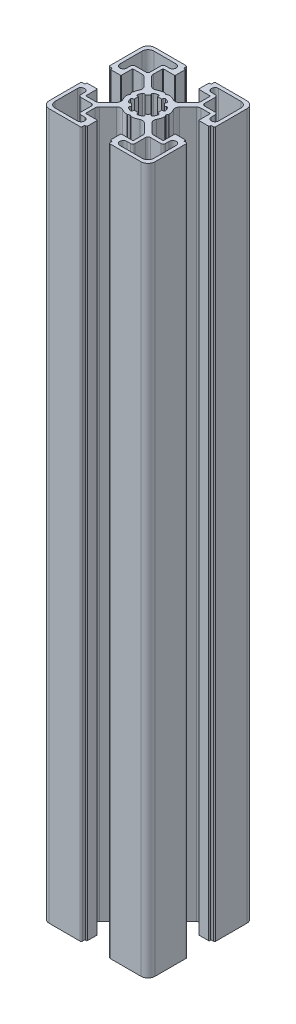
from build123d import *

# Parameters (mm, degrees)
BOSS_EXTRUDE1_DEPTH = 300


with BuildPart() as part:
    # Sketch1 → Boss-Extrude1 (new body)
    with BuildSketch(Plane(origin=(0, 0, 0), x_dir=(1, 0, 0), z_dir=(0, 1, 0))):
        with BuildLine():
            Line((7.563483841, 5.858695924), (11.129779796, 9.424987881))
            ThreePointArc((11.129779796, 9.424987881), (11.76062452, 9.846504465), (12.504756421, 9.994521395))
            Line((12.504756421, 9.994521395), (16.316902359, 9.994521395))
            ThreePointArc((16.316902359, 9.994521395), (16.458323963, 9.935942648), (16.51690271, 9.794521044))
            Line((16.51690271, 9.794521044), (16.51690271, 5.20001408))
            ThreePointArc((16.51690271, 5.20001408), (16.575481456, 5.058592476), (16.716903061, 5.000013729))
            Line((16.716903061, 5.000013729), (20.719599813, 5.000013729))
            ThreePointArc((20.719599813, 5.000013729), (20.931731335, 5.087881483), (21.019599089, 5.300013005))
            Line((21.019599089, 5.300013005), (21.019599089, 5.500003954))
            ThreePointArc((21.019599089, 5.500003954), (21.107466988, 5.71213583), (21.319598864, 5.800003729))
            Line((21.319598864, 5.800003729), (21.999979422, 5.800003729))
            ThreePointArc((21.999979422, 5.800003729), (22.353532548, 5.946450229), (22.499979048, 6.300003356))
            Line((22.499979048, 6.300003356), (22.499979048, 19.500015971))
            ThreePointArc((22.499979048, 19.500015971), (21.621300048, 21.62133473), (19.499981289, 22.50001373))
            Line((19.499981289, 22.50001373), (6.37570892, 22.50001373))
            ThreePointArc((6.37570892, 22.50001373), (6.022155794, 22.35356723), (5.875709294, 22.000014103))
            Line((5.875709294, 22.000014103), (5.875709294, 21.300013005))
            ThreePointArc((5.875709294, 21.300013005), (5.78784154, 21.087881482), (5.575710018, 21.000013729))
            Line((5.575710018, 21.000013729), (5.299998684, 21.000013729))
            ThreePointArc((5.299998684, 21.000013729), (5.087867516, 20.912146122), (4.999999909, 20.700014953))
            Line((4.999999909, 20.700014953), (4.999999909, 16.666812288))
            ThreePointArc((4.999999909, 16.666812288), (5.058578802, 16.52539033), (5.20000076, 16.466811437))
            Line((5.20000076, 16.466811437), (9.905385127, 16.466811437))
            ThreePointArc((9.905385127, 16.466811437), (10.046806731, 16.408232691), (10.105385478, 16.266811086))
            Line((10.105385478, 16.266811086), (10.105385478, 12.471582811))
            ThreePointArc((10.105385478, 12.471582811), (9.953144497, 11.706215717), (9.519598864, 11.057368824))
            Line((9.519598864, 11.057368824), (5.944897897, 7.482667857))
            ThreePointArc((5.944897897, 7.482667857), (4.854602604, 6.96783564), (3.666501718, 7.17329201))
            ThreePointArc((3.666501718, 7.17329201), (2.308631207, 7.714000899), (0.875344921, 8.000128222))
            ThreePointArc((0.875344921, 8.000128222), (0.813048151, 7.996979672), (0.754751151, 7.974792726))
            Line((0.754751151, 7.974792726), (0.112630526, 7.606936313))
            ThreePointArc((0.112630526, 7.606936313), (0.062965968, 7.559088119), (2.065e-06, 7.530953356))
            ThreePointArc((2.065e-06, 7.530953356), (-0.062961837, 7.559088119), (-0.112626394, 7.606936313))
            Line((-0.112626394, 7.606936313), (-0.754745572, 7.974791896))
            ThreePointArc((-0.754745572, 7.974791896), (-0.813042564, 7.99697884), (-0.875339325, 8.000127394))
            ThreePointArc((-0.875339325, 8.000127394), (-2.308625867, 7.714000103), (-3.666496612, 7.173291142))
            ThreePointArc((-3.666496612, 7.173291142), (-4.854599203, 6.967834938), (-5.944895348, 7.482669215))
            Line((-5.944895348, 7.482669215), (-9.519596331, 11.057370197))
            ThreePointArc((-9.519596331, 11.057370197), (-9.953141964, 11.70621709), (-10.105382945, 12.471584185))
            Line((-10.105382945, 12.471584185), (-10.105382945, 16.266811086))
            ThreePointArc((-10.105382945, 16.266811086), (-10.046804198, 16.408232691), (-9.905382594, 16.466811437))
            Line((-9.905382594, 16.466811437), (-5.200000942, 16.466811437))
            ThreePointArc((-5.200000942, 16.466811437), (-5.058578984, 16.52539033), (-5.000000091, 16.666812288))
            Line((-5.000000091, 16.666812288), (-5.000000091, 20.700014953))
            ThreePointArc((-5.000000091, 20.700014953), (-5.087867699, 20.912146122), (-5.299998867, 21.000013729))
            Line((-5.299998867, 21.000013729), (-5.575710202, 21.000013729))
            ThreePointArc((-5.575710202, 21.000013729), (-5.787841724, 21.087881482), (-5.875709478, 21.300013005))
            Line((-5.875709478, 21.300013005), (-5.875709478, 22.000014104))
            ThreePointArc((-5.875709478, 22.000014104), (-6.022155978, 22.35356723), (-6.375709104, 22.50001373))
            Line((-6.375709104, 22.50001373), (-19.499981473, 22.50001373))
            ThreePointArc((-19.499981473, 22.50001373), (-21.621300232, 21.62133473), (-22.499979232, 19.500015971))
            Line((-22.499979232, 19.500015971), (-22.499979232, 6.300003356))
            ThreePointArc((-22.499979232, 6.300003356), (-22.353532732, 5.946450229), (-21.999979605, 5.800003729))
            Line((-21.999979605, 5.800003729), (-21.319599047, 5.800003729))
            ThreePointArc((-21.319599047, 5.800003729), (-21.107467171, 5.71213583), (-21.019599271, 5.500003954))
            Line((-21.019599271, 5.500003954), (-21.019599271, 5.300013005))
            ThreePointArc((-21.019599271, 5.300013005), (-20.931731518, 5.087881483), (-20.719599995, 5.000013729))
            Line((-20.719599995, 5.000013729), (-16.716903244, 5.000013729))
            ThreePointArc((-16.716903244, 5.000013729), (-16.57548164, 5.058592476), (-16.516902894, 5.20001408))
            Line((-16.516902894, 5.20001408), (-16.516902894, 9.794521044))
            ThreePointArc((-16.516902894, 9.794521044), (-16.458324147, 9.935942648), (-16.316902543, 9.994521395))
            Line((-16.316902543, 9.994521395), (-12.504755574, 9.994521395))
            ThreePointArc((-12.504755574, 9.994521395), (-11.760623673, 9.846504465), (-11.129778949, 9.424987881))
            Line((-11.129778949, 9.424987881), (-7.563484024, 5.858696956))
            ThreePointArc((-7.563484024, 5.858696956), (-7.018857309, 4.793955357), (-7.200363541, 3.611860429))
            ThreePointArc((-7.200363541, 3.611860429), (-7.719534914, 2.299057702), (-7.999860794, 0.915436613))
            ThreePointArc((-7.999860794, 0.915436613), (-7.996805132, 0.851929863), (-7.97397167, 0.792591196))
            Line((-7.97397167, 0.792591196), (-7.540055962, 0.046829926))
            ThreePointArc((-7.540055962, 0.046829926), (-7.534291471, 0.023676009), (-7.531325428, 3.7e-07))
            ThreePointArc((-7.531325428, 3.7e-07), (-7.534291471, -0.023675268), (-7.540055962, -0.046829185))
            Line((-7.540055962, -0.046829185), (-7.97397167, -0.792590455))
            ThreePointArc((-7.97397167, -0.792590455), (-7.996805132, -0.851929122), (-7.999860794, -0.915435872))
            ThreePointArc((-7.999860794, -0.915435872), (-7.719534914, -2.299056961), (-7.200363541, -3.611859688))
            ThreePointArc((-7.200363541, -3.611859688), (-7.018857309, -4.793954616), (-7.563484024, -5.858696215))
            Line((-7.563484024, -5.858696215), (-11.12977998, -9.424988171))
            ThreePointArc((-11.12977998, -9.424988171), (-11.760624704, -9.846504756), (-12.504756605, -9.994521685))
            Line((-12.504756605, -9.994521685), (-16.316902543, -9.994521685))
            ThreePointArc((-16.316902543, -9.994521685), (-16.458324147, -9.935942938), (-16.516902894, -9.794521334))
            Line((-16.516902894, -9.794521334), (-16.516902894, -5.200014371))
            ThreePointArc((-16.516902894, -5.200014371), (-16.57548164, -5.058592767), (-16.716903244, -5.000014021))
            Line((-16.716903244, -5.000014021), (-20.719599995, -5.000014021))
            ThreePointArc((-20.719599995, -5.000014021), (-20.931731518, -5.087881774), (-21.019599271, -5.300013296))
            Line((-21.019599271, -5.300013296), (-21.019599271, -5.500004245))
            ThreePointArc((-21.019599271, -5.500004245), (-21.107467171, -5.71213612), (-21.319599047, -5.80000402))
            Line((-21.319599047, -5.80000402), (-21.999979605, -5.80000402))
            ThreePointArc((-21.999979605, -5.80000402), (-22.353532732, -5.94645052), (-22.499979232, -6.300003647))
            Line((-22.499979232, -6.300003647), (-22.499979232, -19.500016261))
            ThreePointArc((-22.499979232, -19.500016261), (-21.621300232, -21.62133502), (-19.499981473, -22.50001402))
            Line((-19.499981473, -22.50001402), (-6.375709104, -22.50001402))
            ThreePointArc((-6.375709104, -22.50001402), (-6.022155978, -22.35356752), (-5.875709478, -22.000014394))
            Line((-5.875709478, -22.000014394), (-5.875709478, -21.300013295))
            ThreePointArc((-5.875709478, -21.300013295), (-5.787841724, -21.087881773), (-5.575710202, -21.000014019))
            Line((-5.575710202, -21.000014019), (-5.299998867, -21.000014019))
            ThreePointArc((-5.299998867, -21.000014019), (-5.087867699, -20.912146412), (-5.000000091, -20.700015244))
            Line((-5.000000091, -20.700015244), (-5.000000091, -16.666812578))
            ThreePointArc((-5.000000091, -16.666812578), (-5.058578984, -16.52539062), (-5.200000942, -16.466811727))
            Line((-5.200000942, -16.466811727), (-9.905382594, -16.466811727))
            ThreePointArc((-9.905382594, -16.466811727), (-10.046804198, -16.40823298), (-10.105382945, -16.266811376))
            Line((-10.105382945, -16.266811376), (-10.105382945, -12.471581681))
            ThreePointArc((-10.105382945, -12.471581681), (-9.953141964, -11.706214586), (-9.519596331, -11.057367693))
            Line((-9.519596331, -11.057367693), (-5.944895364, -7.482666726))
            ThreePointArc((-5.944895364, -7.482666726), (-4.854601518, -6.967832762), (-3.66650075, -7.173286521))
            ThreePointArc((-3.66650075, -7.173286521), (-2.30862839, -7.713996836), (-0.875339942, -8.000124808))
            ThreePointArc((-0.875339942, -8.000124808), (-0.81304361, -7.99697628), (-0.754747019, -7.97478949))
            Line((-0.754747019, -7.97478949), (-0.112626395, -7.606933078))
            ThreePointArc((-0.112626395, -7.606933078), (-0.062961838, -7.559084884), (2.065e-06, -7.530950121))
            ThreePointArc((2.065e-06, -7.530950121), (0.062965968, -7.559084884), (0.112630526, -7.606933078))
            Line((0.112630526, -7.606933078), (0.754751151, -7.974789491))
            ThreePointArc((0.754751151, -7.974789491), (0.813048151, -7.996976437), (0.875344921, -8.000124987))
            ThreePointArc((0.875344921, -8.000124987), (2.308629801, -7.71399808), (3.666499103, -7.173290103))
            ThreePointArc((3.666499103, -7.173290103), (4.854601719, -6.967833865), (5.944897897, -7.482668146))
            Line((5.944897897, -7.482668146), (9.519598864, -11.057369113))
            ThreePointArc((9.519598864, -11.057369113), (9.953144497, -11.706216006), (10.105385478, -12.471583101))
            Line((10.105385478, -12.471583101), (10.105385478, -16.266811376))
            ThreePointArc((10.105385478, -16.266811376), (10.046806731, -16.40823298), (9.905385127, -16.466811727))
            Line((9.905385127, -16.466811727), (5.20000076, -16.466811727))
            ThreePointArc((5.20000076, -16.466811727), (5.058578802, -16.52539062), (4.999999909, -16.666812578))
            Line((4.999999909, -16.666812578), (4.999999909, -20.700015244))
            ThreePointArc((4.999999909, -20.700015244), (5.087867516, -20.912146412), (5.299998684, -21.000014019))
            Line((5.299998684, -21.000014019), (5.575710018, -21.000014019))
            ThreePointArc((5.575710018, -21.000014019), (5.78784154, -21.087881773), (5.875709294, -21.300013295))
            Line((5.875709294, -21.300013295), (5.875709294, -22.000014394))
            ThreePointArc((5.875709294, -22.000014394), (6.022155794, -22.35356752), (6.37570892, -22.50001402))
            Line((6.37570892, -22.50001402), (19.499981289, -22.50001402))
            ThreePointArc((19.499981289, -22.50001402), (21.621300048, -21.62133502), (22.499979048, -19.500016261))
            Line((22.499979048, -19.500016261), (22.499979048, -6.300003646))
            ThreePointArc((22.499979048, -6.300003646), (22.353532548, -5.94645052), (21.999979422, -5.80000402))
            Line((21.999979422, -5.80000402), (21.319598864, -5.80000402))
            ThreePointArc((21.319598864, -5.80000402), (21.107466988, -5.71213612), (21.019599089, -5.500004245))
            Line((21.019599089, -5.500004245), (21.019599089, -5.300013297))
            ThreePointArc((21.019599089, -5.300013297), (20.931731335, -5.087881774), (20.719599813, -5.000014021))
            Line((20.719599813, -5.000014021), (16.716903061, -5.000014021))
            ThreePointArc((16.716903061, -5.000014021), (16.575481456, -5.058592767), (16.51690271, -5.200014371))
            Line((16.51690271, -5.200014371), (16.51690271, -9.794521334))
            ThreePointArc((16.51690271, -9.794521334), (16.458323963, -9.935942938), (16.316902359, -9.994521685))
            Line((16.316902359, -9.994521685), (12.504756421, -9.994521685))
            ThreePointArc((12.504756421, -9.994521685), (11.76062452, -9.846504756), (11.129779797, -9.424988171))
            Line((11.129779797, -9.424988171), (7.56348384, -5.858696215))
            ThreePointArc((7.56348384, -5.858696215), (7.018857125, -4.793954616), (7.200363357, -3.611859689))
            ThreePointArc((7.200363357, -3.611859689), (7.71953473, -2.299056961), (7.99986061, -0.915435872))
            ThreePointArc((7.99986061, -0.915435872), (7.996804948, -0.851929122), (7.973971486, -0.792590456))
            Line((7.973971486, -0.792590456), (7.54005578, -0.046829188))
            ThreePointArc((7.54005578, -0.046829188), (7.53429135, -0.023675779), (7.531325245, -6.6e-07))
            ThreePointArc((7.531325245, -6.6e-07), (7.534291289, 0.023674979), (7.54005578, 0.046828898))
            Line((7.54005578, 0.046828898), (7.973971486, 0.792590166))
            ThreePointArc((7.973971486, 0.792590166), (7.996804949, 0.851928832), (7.99986061, 0.915435582))
            ThreePointArc((7.99986061, 0.915435582), (7.719534731, 2.299056671), (7.200363358, 3.611859399))
            ThreePointArc((7.200363358, 3.611859399), (7.018857126, 4.793954326), (7.563483841, 5.858695924))
        make_face()
        with BuildLine():
            Line((-17.99997923, 9.000204729), (-17.99997923, 10.550013476))
            ThreePointArc((-17.99997923, 10.550013476), (-17.70708623, 11.257119729), (-16.999979977, 11.550012729))
            Line((-16.999979977, 11.550012729), (-12.549977483, 11.550012729))
            ThreePointArc((-12.549977483, 11.550012729), (-11.84287123, 11.842905729), (-11.54997823, 12.550011982))
            Line((-11.54997823, 12.550011982), (-11.54997823, 17.000014476))
            ThreePointArc((-11.54997823, 17.000014476), (-11.25708523, 17.707120729), (-10.549978977, 18.000013729))
            Line((-10.549978977, 18.000013729), (-8.99997923, 18.000013729))
            ThreePointArc((-8.99997923, 18.000013729), (-7.49997923, 19.500013729), (-8.99997923, 21.000013729))
            Line((-8.99997923, 21.000013729), (-18.499981098, 21.000013729))
            ThreePointArc((-18.499981098, 21.000013729), (-20.26774673, 20.267781229), (-20.99997923, 18.500015597))
            Line((-20.99997923, 18.500015597), (-20.99997923, 9.000204729))
            ThreePointArc((-20.99997923, 9.000204729), (-19.49997923, 7.500204729), (-17.99997923, 9.000204729))
        make_face(mode=Mode.SUBTRACT)
        with BuildLine():
            Line((0.967518273, 5.481094418), (0.867385333, 4.924170439))
            ThreePointArc((0.867385333, 4.924170439), (-3.404e-06, 4.999981493), (-0.867392141, 4.924170439))
            Line((-0.867392141, 4.924170439), (-0.967525085, 5.48109443))
            ThreePointArc((-0.967525085, 5.48109443), (-1.18787304, 5.829596016), (-1.595121059, 5.894060173))
            ThreePointArc((-1.595121059, 5.894060173), (-2.337474987, 5.644060679), (-3.0416713, 5.300991221))
            ThreePointArc((-3.0416713, 5.300991221), (-3.284300912, 4.965857552), (-3.191387249, 4.562681715))
            Line((-3.191387249, 4.562681715), (-2.864003826, 4.098457013))
            ThreePointArc((-2.864003826, 4.098457013), (-3.530136355, 3.540908116), (-4.089716295, 2.876480837))
            Line((-4.089716295, 2.876480837), (-4.566781049, 3.208143991))
            ThreePointArc((-4.566781049, 3.208143991), (-4.968981864, 3.298752353), (-5.302521511, 3.056416481))
            ThreePointArc((-5.302521511, 3.056416481), (-5.650679971, 2.354692469), (-5.906040083, 1.614137194))
            ThreePointArc((-5.906040083, 1.614137194), (-5.840630787, 1.205603075), (-5.48985103, 0.986212864))
            Line((-5.48985103, 0.986212864), (-4.920549171, 0.887804317))
            ThreePointArc((-4.920549171, 0.887804317), (-5.000003405, -1.8509e-05), (-4.92054917, -0.887841334))
            Line((-4.92054917, -0.887841334), (-5.48973413, -0.986229672))
            ThreePointArc((-5.48973413, -0.986229672), (-5.84059179, -1.205595835), (-5.906027737, -1.614179668))
            ThreePointArc((-5.906027737, -1.614179668), (-5.650660878, -2.354735576), (-5.302495324, -3.056459191))
            ThreePointArc((-5.302495324, -3.056459191), (-4.968965627, -3.298777294), (-4.566781049, -3.208181006))
            Line((-4.566781049, -3.208181006), (-4.089716295, -2.876517852))
            ThreePointArc((-4.089716295, -2.876517852), (-3.530136355, -3.540945131), (-2.864003826, -4.098494028))
            Line((-2.864003826, -4.098494028), (-3.191315305, -4.562616715))
            ThreePointArc((-3.191315305, -4.562616715), (-3.284288314, -4.9658247), (-3.041645074, -5.301003633))
            ThreePointArc((-3.041645074, -5.301003633), (-2.337436005, -5.644074141), (-1.595068803, -5.894071587))
            ThreePointArc((-1.595068803, -5.894071587), (-1.187863583, -5.829591875), (-0.967525085, -5.481131446))
            Line((-0.967525085, -5.481131446), (-0.867392142, -4.924207454))
            ThreePointArc((-0.867392142, -4.924207454), (-3.405e-06, -5.000018508), (0.867385333, -4.924207454))
            Line((0.867385333, -4.924207454), (0.967518273, -5.481131433))
            ThreePointArc((0.967518273, -5.481131433), (1.187884068, -5.829612183), (1.595127065, -5.894056407))
            ThreePointArc((1.595127065, -5.894056407), (2.337463214, -5.64406402), (3.04164388, -5.301006091))
            ThreePointArc((3.04164388, -5.301006091), (3.284272431, -4.965888777), (3.191382531, -4.562721697))
            Line((3.191382531, -4.562721697), (2.863997017, -4.098494027))
            ThreePointArc((2.863997017, -4.098494027), (3.530129546, -3.540945131), (4.089709486, -2.876517851))
            Line((4.089709486, -2.876517851), (4.56677425, -3.208181013))
            ThreePointArc((4.56677425, -3.208181013), (4.968991235, -3.298778206), (5.302526078, -3.056413061))
            ThreePointArc((5.302526078, -3.056413061), (5.650679647, -2.354700627), (5.90603791, -1.614157983))
            ThreePointArc((5.90603791, -1.614157983), (5.840629826, -1.205623017), (5.489849863, -0.98623192))
            Line((5.489849863, -0.98623192), (4.920545674, -0.88782297))
            ThreePointArc((4.920545674, -0.88782297), (4.999996595, -1.94e-07), (4.92053917, 0.887822))
            Line((4.92053917, 0.887822), (5.489724104, 0.986210336))
            ThreePointArc((5.489724104, 0.986210336), (5.840595493, 1.20557008), (5.90603791, 1.614161218))
            ThreePointArc((5.90603791, 1.614161218), (5.650669489, 2.354728137), (5.302499707, 3.056461843))
            ThreePointArc((5.302499707, 3.056461843), (4.968955649, 3.298763634), (4.56677425, 3.208143998))
            Line((4.56677425, 3.208143998), (4.089709486, 2.876480836))
            ThreePointArc((4.089709486, 2.876480836), (3.530129546, 3.540908115), (2.863997017, 4.098457012))
            Line((2.863997017, 4.098457012), (3.191308496, 4.562579701))
            ThreePointArc((3.191308496, 4.562579701), (3.284310107, 4.965799272), (3.041663899, 5.300997928))
            ThreePointArc((3.041663899, 5.300997928), (2.337448292, 5.644073372), (1.595073641, 5.894073887))
            ThreePointArc((1.595073641, 5.894073887), (1.18784779, 5.829586125), (0.967518273, 5.481094418))
        make_face(mode=Mode.SUBTRACT)
        with BuildLine():
            Line((-20.99997923, -9.000205019), (-20.99997923, -18.500015887))
            ThreePointArc((-20.99997923, -18.500015887), (-20.26774673, -20.267781519), (-18.499981098, -21.000014019))
            Line((-18.499981098, -21.000014019), (-8.99997923, -21.000014019))
            ThreePointArc((-8.99997923, -21.000014019), (-7.49997923, -19.500014019), (-8.99997923, -18.000014019))
            Line((-8.99997923, -18.000014019), (-10.549978977, -18.000014019))
            ThreePointArc((-10.549978977, -18.000014019), (-11.25708523, -17.707121019), (-11.54997823, -17.000014766))
            Line((-11.54997823, -17.000014766), (-11.54997823, -12.550012272))
            ThreePointArc((-11.54997823, -12.550012272), (-11.84287123, -11.842906019), (-12.549977483, -11.550013019))
            Line((-12.549977483, -11.550013019), (-16.999979977, -11.550013019))
            ThreePointArc((-16.999979977, -11.550013019), (-17.70708623, -11.257120019), (-17.99997923, -10.550013766))
            Line((-17.99997923, -10.550013766), (-17.99997923, -9.000205019))
            ThreePointArc((-17.99997923, -9.000205019), (-19.49997923, -7.500205019), (-20.99997923, -9.000205019))
        make_face(mode=Mode.SUBTRACT)
        with BuildLine():
            Line((20.999979046, 9.000204729), (20.999979046, 18.500015597))
            ThreePointArc((20.999979046, 18.500015597), (20.267746546, 20.267781229), (18.499980914, 21.000013729))
            Line((18.499980914, 21.000013729), (8.999979046, 21.000013729))
            ThreePointArc((8.999979046, 21.000013729), (7.499979046, 19.500013729), (8.999979046, 18.000013729))
            Line((8.999979046, 18.000013729), (10.549978793, 18.000013729))
            ThreePointArc((10.549978793, 18.000013729), (11.257085046, 17.707120729), (11.549978046, 17.000014476))
            Line((11.549978046, 17.000014476), (11.549978046, 12.550011982))
            ThreePointArc((11.549978046, 12.550011982), (11.842871046, 11.842905729), (12.549977299, 11.550012729))
            Line((12.549977299, 11.550012729), (16.999979793, 11.550012729))
            ThreePointArc((16.999979793, 11.550012729), (17.707086046, 11.257119729), (17.999979046, 10.550013476))
            Line((17.999979046, 10.550013476), (17.999979046, 9.000204729))
            ThreePointArc((17.999979046, 9.000204729), (19.499979046, 7.500204729), (20.999979046, 9.000204729))
        make_face(mode=Mode.SUBTRACT)
        with BuildLine():
            Line((16.999979793, -11.550013019), (12.549977299, -11.550013019))
            ThreePointArc((12.549977299, -11.550013019), (11.842871046, -11.842906019), (11.549978046, -12.550012272))
            Line((11.549978046, -12.550012272), (11.549978046, -17.000014766))
            ThreePointArc((11.549978046, -17.000014766), (11.257085046, -17.707121019), (10.549978793, -18.000014019))
            Line((10.549978793, -18.000014019), (8.999979046, -18.000014019))
            ThreePointArc((8.999979046, -18.000014019), (7.499979046, -19.500014019), (8.999979046, -21.000014019))
            Line((8.999979046, -21.000014019), (18.499980914, -21.000014019))
            ThreePointArc((18.499980914, -21.000014019), (20.267746546, -20.267781519), (20.999979046, -18.500015887))
            Line((20.999979046, -18.500015887), (20.999979046, -9.000205019))
            ThreePointArc((20.999979046, -9.000205019), (19.499979046, -7.500205019), (17.999979046, -9.000205019))
            Line((17.999979046, -9.000205019), (17.999979046, -10.550013766))
            ThreePointArc((17.999979046, -10.550013766), (17.707086046, -11.257120019), (16.999979793, -11.550013019))
        make_face(mode=Mode.SUBTRACT)
    extrude(amount=BOSS_EXTRUDE1_DEPTH)


solid = part.part
